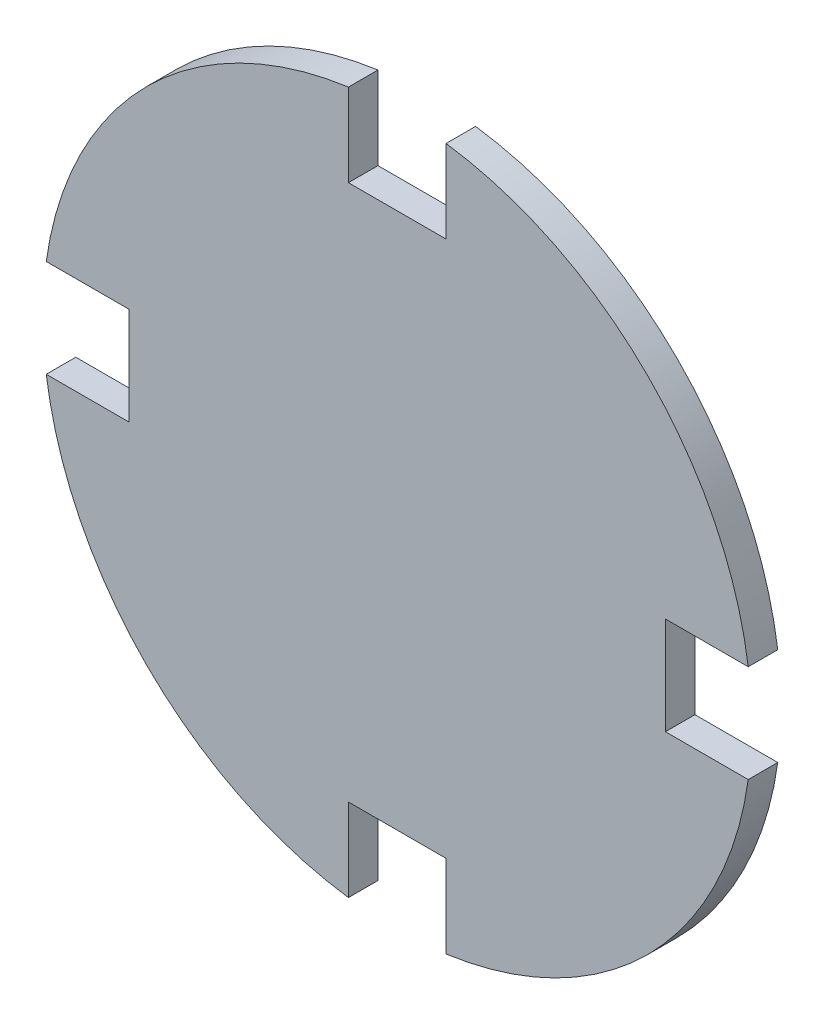
from build123d import *

# Parameters (mm, degrees)
BOSS_EXTRUDE1_DEPTH = 6.35


with BuildPart() as part:
    # Sketch1 → Boss-Extrude1 (new, symmetric)
    with BuildSketch(Plane.XY):
        with BuildLine():
            Line((150.946215587, -21), (115.332, -21))
            Line((115.332, -21), (115.332, 21))
            Line((115.332, 21), (150.946215587, 21))
            ThreePointArc((150.946215587, 21), (107.763073453, 107.763073453), (21, 150.946215587))
            Line((21, 150.946215587), (21, 115.332))
            Line((21, 115.332), (-21, 115.332))
            Line((-21, 115.332), (-21, 150.946215587))
            ThreePointArc((-21, 150.946215587), (-107.763073453, 107.763073453), (-150.946215587, 21))
            Line((-150.946215587, 21), (-115.332, 21))
            Line((-115.332, 21), (-115.332, -21))
            Line((-115.332, -21), (-150.946215587, -21))
            ThreePointArc((-150.946215587, -21), (-107.763073453, -107.763073453), (-21, -150.946215587))
            Line((-21, -150.946215587), (-21, -115.332))
            Line((-21, -115.332), (21, -115.332))
            Line((21, -115.332), (21, -150.946215587))
            ThreePointArc((21, -150.946215587), (107.763073453, -107.763073453), (150.946215587, -21))
        make_face()
    extrude(amount=BOSS_EXTRUDE1_DEPTH, both=True)


solid = part.part
